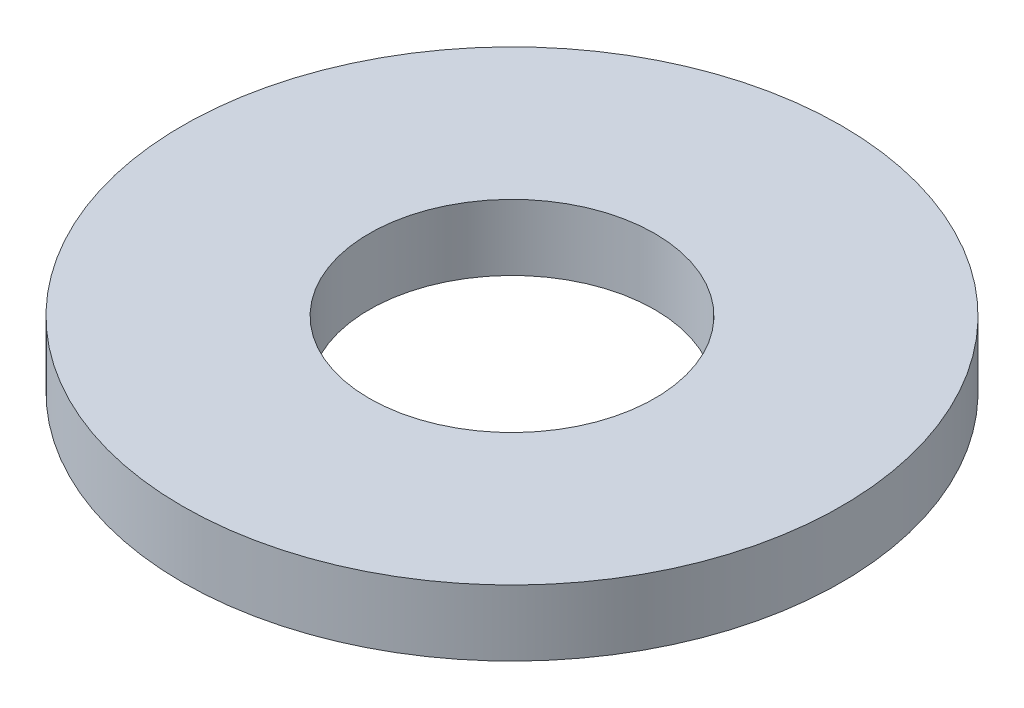
from build123d import *

# Parameters (mm, degrees)
SKETCH_1_R      = 15
SKETCH_1_R_2    = 6.5
EXTRUDE_1_DEPTH = 3


with BuildPart() as part:
    # Эскиз1 → Бобышка-Вытянуть1 (new body)
    with BuildSketch(Plane(origin=(0, 0, 0), x_dir=(1, 0, 0), z_dir=(0, 1, 0))):
        with Locations(Location((0, 0, 0), (0, 0, 270))):
            Circle(SKETCH_1_R)
        with Locations(Location((0, 0, 0), (0, 0, 270))):
            Circle(SKETCH_1_R_2, mode=Mode.SUBTRACT)
    extrude(amount=EXTRUDE_1_DEPTH)


solid = part.part
